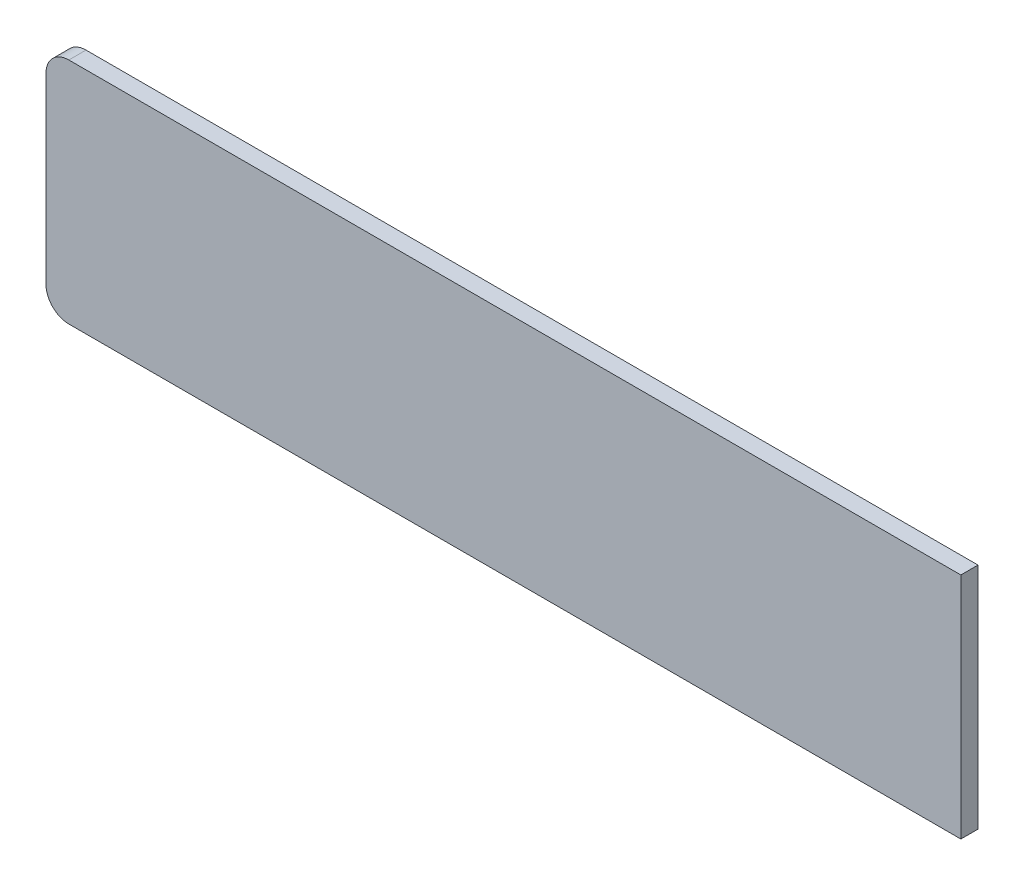
from build123d import *

# Parameters (mm, degrees)
EXTRUDE_1_DEPTH = 1.5


with BuildPart() as part:
    # Эскиз1 → Бобышка-Вытянуть1 (new body)
    with BuildSketch(Plane.XY):
        with BuildLine():
            Line((-92.951511498, 44.165693097), (-14.951511498, 44.165693097))
            Line((-14.951511498, 44.165693097), (-14.951511498, 24.165693097))
            Line((-14.951511498, 24.165693097), (-92.951511498, 24.165693097))
            ThreePointArc((-92.951511498, 24.165693097), (-94.365725061, 24.751479535), (-94.951511498, 26.165693097))
            Line((-94.951511498, 26.165693097), (-94.951511498, 42.165693097))
            ThreePointArc((-94.951511498, 42.165693097), (-94.365725061, 43.57990666), (-92.951511498, 44.165693097))
        make_face()
    extrude(amount=EXTRUDE_1_DEPTH)


solid = part.part
